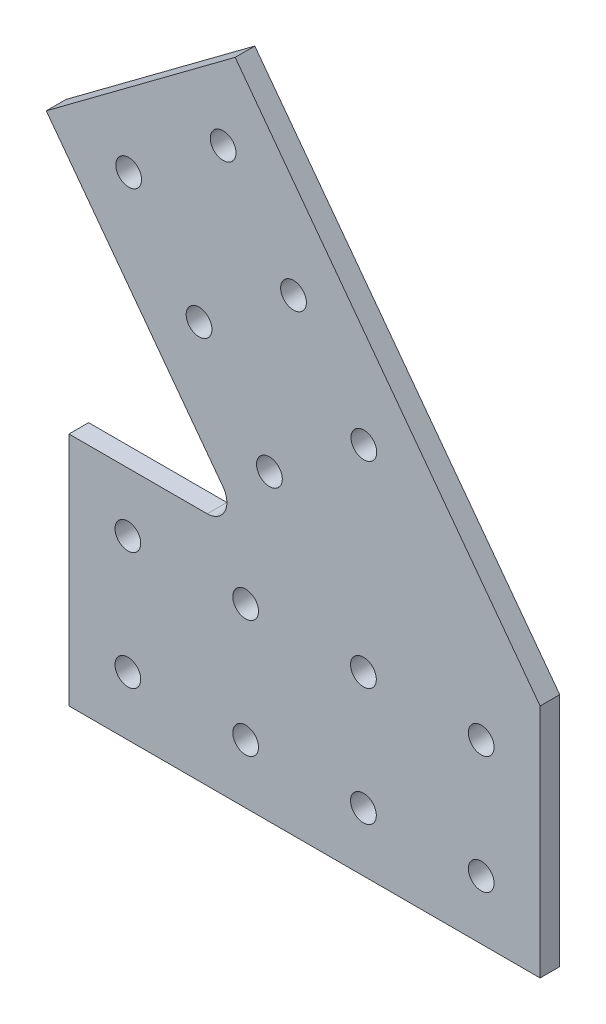
from build123d import *

# Parameters (mm, degrees)
BOSS_EXTRUDE1_DEPTH              = 6.35
F_21_64_0_32813_DIAMETER_HOLE1_D = 8.334502
LPATTERN1_COUNT                  = 4
LPATTERN1_PITCH                  = 38.1
LPATTERN1_COUNT_DIR2             = 2
LPATTERN1_PITCH_DIR2             = 38.1
F_21_64_0_32813_DIAMETER_HOLE2_D = 8.334502
LPATTERN2_COUNT                  = 3
LPATTERN2_PITCH                  = 38.1
LPATTERN2_COUNT_DIR2             = 2
LPATTERN2_PITCH_DIR2             = 38.1
FILLET1_R                        = 6.35


with BuildPart() as part:
    # Sketch2 → Boss-Extrude1 (new body)
    with BuildSketch(Plane.XY):
        Polygon((0, 0), (152.4, 0), (152.4, 76.2), (53.755193212, 208.590377648), (-7.34805801, 163.062005284), (57.373305284, 76.2), (0, 76.2), align=None)
    extrude(amount=BOSS_EXTRUDE1_DEPTH)

    # 21/64 (0.32813) Diameter Hole1 (through all)
    with Locations(Plane.XY.offset(6.35)):
        with Locations((133.35, 19.05)):
            f_21_64_0_32813_diameter_hole1 = Hole(F_21_64_0_32813_DIAMETER_HOLE1_D / 2)

    # LPattern1: 21_64 _0.32813_ Diameter Hole1 4 × 2
    with Locations(*[(-i * LPATTERN1_PITCH, j * LPATTERN1_PITCH_DIR2, 0) for i in range(LPATTERN1_COUNT) for j in range(LPATTERN1_COUNT_DIR2) if (i, j) != (0, 0)]):
        add(f_21_64_0_32813_diameter_hole1, mode=Mode.SUBTRACT)

    # 21/64 (0.32813) Diameter Hole2 (through all)
    with Locations(Plane.XY.offset(6.35)):
        with Locations((49.861473497, 181.932471751)):
            f_21_64_0_32813_diameter_hole2 = Hole(F_21_64_0_32813_DIAMETER_HOLE2_D / 2)

    # LPattern2: 21_64 _0.32813_ Diameter Hole2 3 × 2
    with Locations(*[Vector(0.5974852016253348, -0.8018799372965589, 0) * (i * LPATTERN2_PITCH) + Vector(-0.8018799372965586, -0.5974852016253351, 0) * (j * LPATTERN2_PITCH_DIR2) for i in range(LPATTERN2_COUNT) for j in range(LPATTERN2_COUNT_DIR2) if (i, j) != (0, 0)]):
        add(f_21_64_0_32813_diameter_hole2, mode=Mode.SUBTRACT)

    # Fillet1
    fillet1_edges = [part.edges().sort_by_distance(p)[0] for p in [
        (57.373305284, 76.2, 3.175),
    ]]
    fillet(fillet1_edges, radius=FILLET1_R)


solid = part.part
